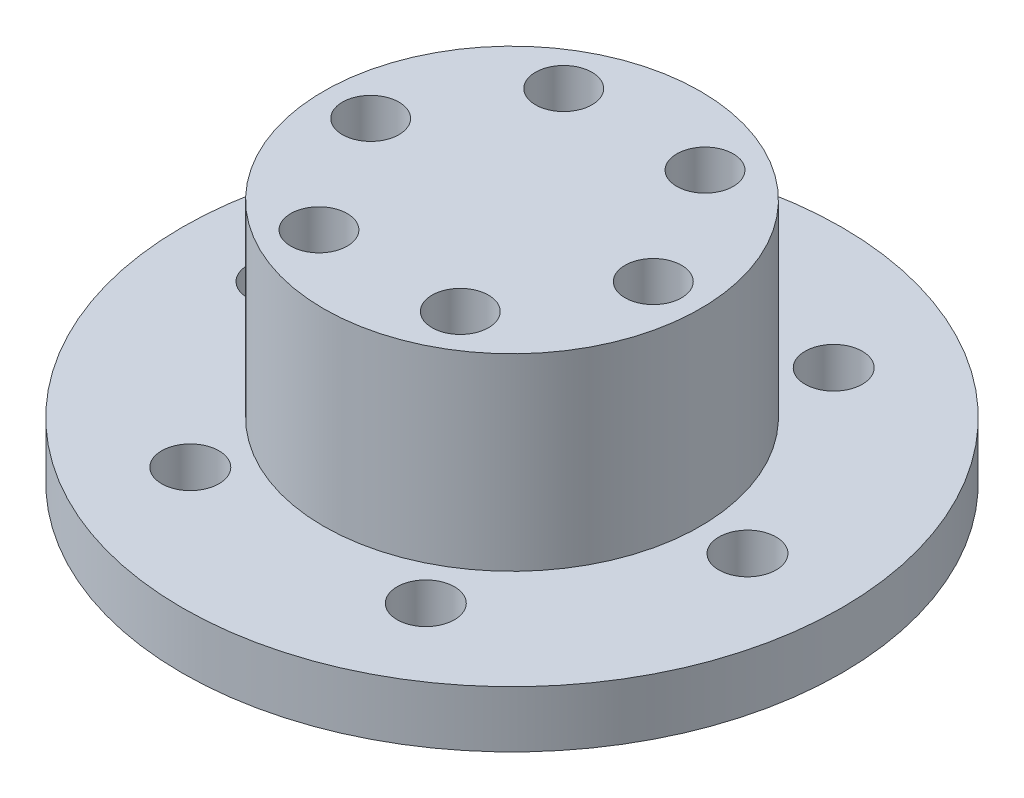
from build123d import *

# Parameters (mm, degrees)
CROQUIS1_R              = 17.5
CROQUIS1_R_2            = 1.52
SALIENTE_EXTRUIR1_DEPTH = 3
CROQUIS2_R              = 10
CROQUIS2_R_2            = 1.5
SALIENTE_EXTRUIR2_DEPTH = 10


with BuildPart() as part:
    # Croquis1 → Saliente-Extruir1 (new body)
    with BuildSketch(Plane(origin=(0, 0, 0), x_dir=(1, 0, 0), z_dir=(0, 1, 0))):
        with Locations(Location((0, 0, 0), (0, 0, 270))):
            Circle(CROQUIS1_R)
        with Locations(Location((12.5, 0, 0), (0, 0, 270))):
            Circle(CROQUIS1_R_2, mode=Mode.SUBTRACT)
        with Locations(Location((6.25, -10.825317547, 0), (0, 0, 270))):
            Circle(CROQUIS1_R_2, mode=Mode.SUBTRACT)
        with Locations(Location((-6.25, -10.825317547, 0), (0, 0, 270))):
            Circle(CROQUIS1_R_2, mode=Mode.SUBTRACT)
        with Locations(Location((-12.5, 0, 0), (0, 0, 270))):
            Circle(CROQUIS1_R_2, mode=Mode.SUBTRACT)
        with Locations(Location((-6.25, 10.825317547, 0), (0, 0, 270))):
            Circle(CROQUIS1_R_2, mode=Mode.SUBTRACT)
        with Locations(Location((6.25, 10.825317547, 0), (0, 0, 270))):
            Circle(CROQUIS1_R_2, mode=Mode.SUBTRACT)
    extrude(amount=SALIENTE_EXTRUIR1_DEPTH)

    # Croquis2 → Saliente-Extruir2 (add)
    with BuildSketch(Plane(origin=(0, 3, 0), x_dir=(1, 0, 0), z_dir=(0, 1, 0))):
        with Locations(Location((0, 0, 0), (0, 0, 270))):
            Circle(CROQUIS2_R)
        with Locations(Location((7.5, 0, 0), (0, 0, 270))):
            Circle(CROQUIS2_R_2, mode=Mode.SUBTRACT)
        with Locations(Location((3.75, -6.495190528, 0), (0, 0, 270))):
            Circle(CROQUIS2_R_2, mode=Mode.SUBTRACT)
        with Locations(Location((-3.75, -6.495190528, 0), (0, 0, 270))):
            Circle(CROQUIS2_R_2, mode=Mode.SUBTRACT)
        with Locations(Location((-7.5, 0, 0), (0, 0, 270))):
            Circle(CROQUIS2_R_2, mode=Mode.SUBTRACT)
        with Locations(Location((-3.75, 6.495190528, 0), (0, 0, 270))):
            Circle(CROQUIS2_R_2, mode=Mode.SUBTRACT)
        with Locations(Location((3.75, 6.495190528, 0), (0, 0, 270))):
            Circle(CROQUIS2_R_2, mode=Mode.SUBTRACT)
    extrude(amount=SALIENTE_EXTRUIR2_DEPTH)


solid = part.part
